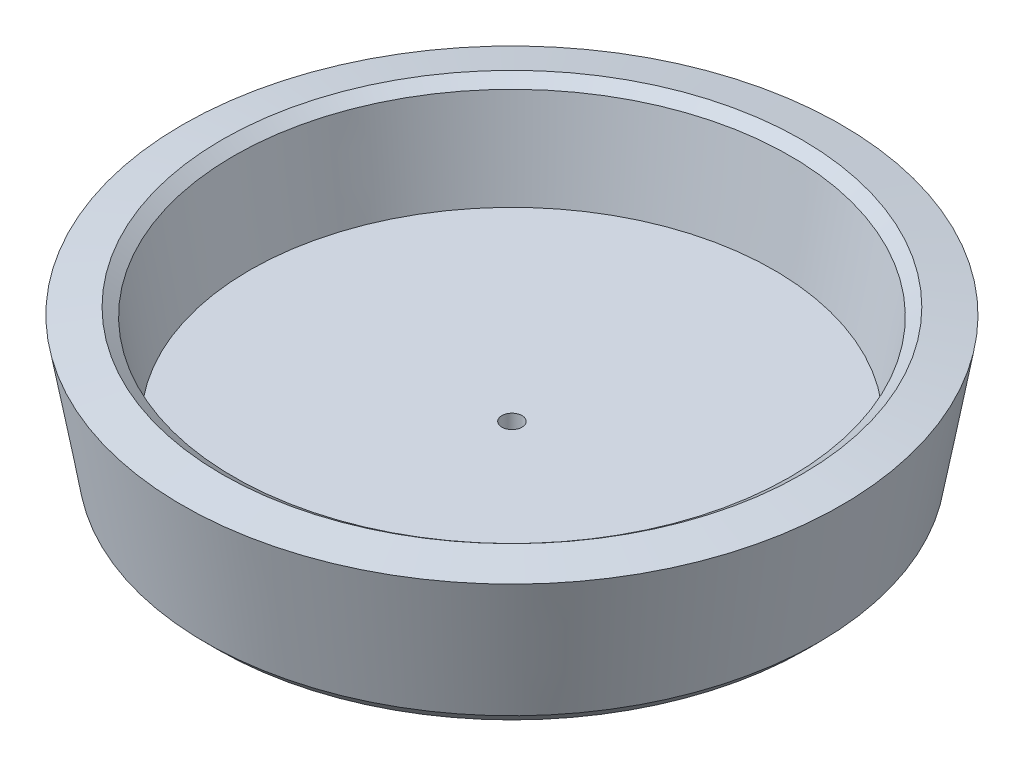
from build123d import *

# Parameters (mm, degrees)
CHAMFER_1_SIZE      = 1
CHAMFER_1_SIZE2     = 1.232803052
CHAMFER_2_SIZE      = 1
SKETCH_4_R          = 1
CUT_EXTRUDE_1_DEPTH = 10


with BuildPart() as part:
    # 草图3 → 旋转1 (revolve)
    with BuildSketch(Plane.XY):
        Polygon((0, 0), (-30.195498156, 0), (-32.687308572, 14.131759112), (-27.763269807, 15), (-26, 5), (0, 5), align=None)
    revolve(axis=Axis((0, 5, 0), (0, -1, 0)))

    # 倒角1
    chamfer_1_edges = [part.edges().sort_by_distance(p)[0] for p in [
        (30.195498156, 0, 0),
    ]]
    chamfer_1_side = [part.faces().sort_by_distance(p)[0] for p in [
        (0, 0, 0),
    ]]
    chamfer(chamfer_1_edges, length=CHAMFER_1_SIZE, length2=CHAMFER_1_SIZE2, reference=chamfer_1_side[0])

    # 倒角2
    chamfer_2_edges = [part.edges().sort_by_distance(p)[0] for p in [
        (27.763269807, 15, 0),
    ]]
    chamfer(chamfer_2_edges, length=CHAMFER_2_SIZE)

    # 草图4 → 切除-拉伸1 (cut)
    with BuildSketch(Plane(origin=(0, 5, 0), x_dir=(1, 0, 0), z_dir=(0, 1, 0))):
        with Locations(Location((0, 0, 0), (0, 0, 180))):
            Circle(SKETCH_4_R)
    extrude(amount=-CUT_EXTRUDE_1_DEPTH, mode=Mode.SUBTRACT)


solid = part.part
